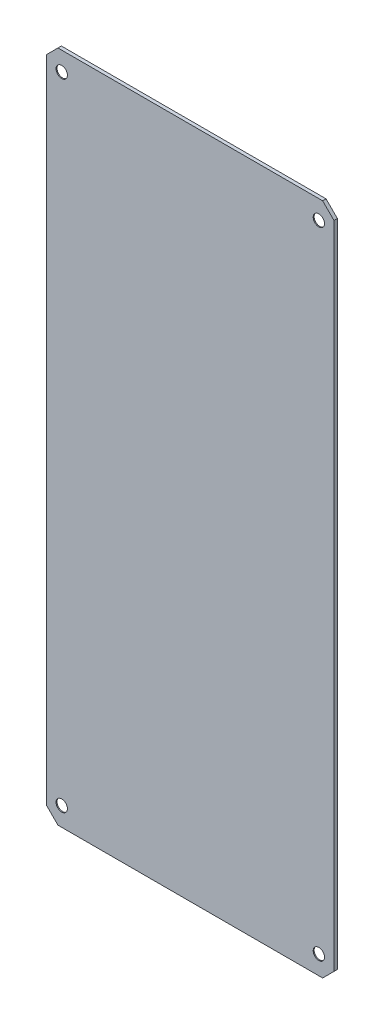
from build123d import *

# Parameters (mm, degrees)
SKETCH2_W           = 76
SKETCH2_H           = 178
BOSS_EXTRUDE1_DEPTH = 0.9
SKETCH4_R           = 2.667
CUT_EXTRUDE1_DEPTH  = 2
SKETCH5_R           = 2.667
SKETCH5_R_2         = 1.5
BOSS_EXTRUDE2_DEPTH = 0.254
CHAMFER1_SIZE       = 3


with BuildPart() as part:
    # Sketch2 → Boss-Extrude1 (new body)
    with BuildSketch(Plane.XY):
        with Locations((38, 89)):
            Rectangle(SKETCH2_W, SKETCH2_H)
    extrude(amount=BOSS_EXTRUDE1_DEPTH)

    # Sketch4 → Cut-Extrude1 (cut)
    with BuildSketch(Plane.XY.offset(0.9)):
        with Locations((4, 173)):
            Circle(SKETCH4_R)
        with Locations((72, 173)):
            Circle(SKETCH4_R)
        with Locations((72, 5)):
            Circle(SKETCH4_R)
        with Locations((4, 5)):
            Circle(SKETCH4_R)
    extrude(amount=-CUT_EXTRUDE1_DEPTH, mode=Mode.SUBTRACT)

    # Sketch5 → Boss-Extrude2 (add)
    # profile 1 of 4: a face of its own
    with BuildSketch(Plane.XY.offset(0.9)):
        with Locations((4, 5)):
            Circle(SKETCH5_R)
        with Locations(Location((4, 5, 0), (0, 0, 180))):
            Circle(SKETCH5_R_2, mode=Mode.SUBTRACT)
    # profile 2 of 4: a face of its own
    with BuildSketch(Plane.XY.offset(0.9)):
        with Locations((4, 173)):
            Circle(SKETCH5_R)
        with Locations((4, 173)):
            Circle(SKETCH5_R_2, mode=Mode.SUBTRACT)
    # profile 3 of 4: a face of its own
    with BuildSketch(Plane.XY.offset(0.9)):
        with Locations((72, 5)):
            Circle(SKETCH5_R)
        with Locations((72, 5)):
            Circle(SKETCH5_R_2, mode=Mode.SUBTRACT)
    # profile 4 of 4: a face of its own
    with BuildSketch(Plane.XY.offset(0.9)):
        with Locations((72, 173)):
            Circle(SKETCH5_R)
        with Locations(Location((72, 173, 0), (0, 0, 180))):
            Circle(SKETCH5_R_2, mode=Mode.SUBTRACT)
    extrude(amount=-BOSS_EXTRUDE2_DEPTH)

    # Chamfer1
    chamfer1_edges = [part.edges().sort_by_distance(p)[0] for p in [
        (0, 178, 0.45),
        (76, 178, 0.45),
        (76, 0, 0.45),
        (0, 0, 0.45),
    ]]
    chamfer(chamfer1_edges, length=CHAMFER1_SIZE)


solid = part.part
